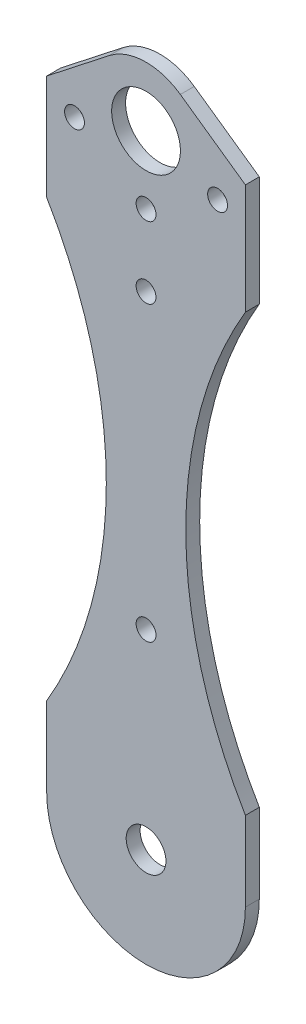
from build123d import *

# Parameters (mm, degrees)
SKETCH2_R           = 6.35
SKETCH2_R_2         = 3.175
SKETCH2_R_3         = 10.9855
BOSS_EXTRUDE1_DEPTH = 4.445
SKETCH4_R           = 3.175
CUT_EXTRUDE2_DEPTH  = 148.450257689
CUT_EXTRUDE3_DEPTH  = 148.450257689


with BuildPart() as part:
    # Sketch2 → Boss-Extrude1 (new body)
    with BuildSketch(Plane.XY):
        with BuildLine():
            Line((31.75, 112.17275), (-31.75, 112.17275))
            Line((-31.75, 112.17275), (-31.75, 52.48275))
            ThreePointArc((-31.75, 52.48275), (-12.7, -17.145), (-31.75, -86.77275))
            Line((-31.75, -86.77275), (-31.75, -112.17275))
            ThreePointArc((-31.75, -112.17275), (0, -143.92275), (31.75, -112.17275))
            Line((31.75, -112.17275), (31.75, -86.77275))
            ThreePointArc((31.75, -86.77275), (12.7, -17.145), (31.75, 52.48275))
            Line((31.75, 52.48275), (31.75, 112.17275))
        make_face()
        with Locations((0, -112.17275)):
            Circle(SKETCH2_R, mode=Mode.SUBTRACT)
        with Locations((-22.86, 79.15275)):
            Circle(SKETCH2_R_2, mode=Mode.SUBTRACT)
        with Locations((0, 65.18275)):
            Circle(SKETCH2_R_2, mode=Mode.SUBTRACT)
        with Locations((0, 86.77275)):
            Circle(SKETCH2_R_3, mode=Mode.SUBTRACT)
        with Locations((22.86, 79.15275)):
            Circle(SKETCH2_R_2, mode=Mode.SUBTRACT)
    extrude(amount=BOSS_EXTRUDE1_DEPTH)

    # Sketch4 → Cut-Extrude2 (cut, through all)
    with BuildSketch(Plane.XY.offset(4.445)):
        with Locations((0, 42.32275)):
            Circle(SKETCH4_R)
        with Locations((0, -51.21275)):
            Circle(SKETCH4_R)
    extrude(amount=-CUT_EXTRUDE2_DEPTH, mode=Mode.SUBTRACT)

    # Sketch6 → Cut-Extrude3 (cut, through all)
    with BuildSketch(Plane(origin=(0, 0, 0), x_dir=(-1, 0, 0), z_dir=(0, 0, -1))):
        with BuildLine():
            Line((-31.75, 87.727850063), (-10.961308866, 102.353257307))
            ThreePointArc((-10.961308866, 102.353257307), (0.491450562, 105.816409741), (11.750340751, 101.767148695))
            Line((11.750340751, 101.767148695), (31.75, 86.094442115))
            Line((31.75, 86.094442115), (31.75, 114.970728373))
            Line((31.75, 114.970728373), (-31.75, 114.970728373))
            Line((-31.75, 114.970728373), (-31.75, 87.727850063))
        make_face()
    extrude(amount=-CUT_EXTRUDE3_DEPTH, mode=Mode.SUBTRACT)


solid = part.part
